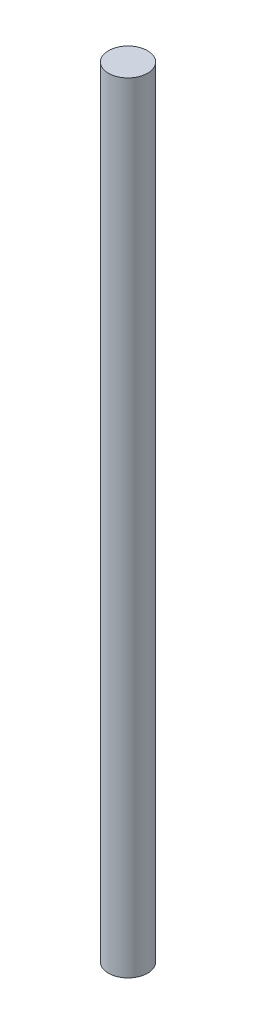
from build123d import *

# Parameters (mm, degrees)
ESBO_O1_W = 39.18
ESBO_O1_H = 1561.37


with BuildPart() as part:
    # Esboço1 → Revolução1 (revolve)
    with BuildSketch(Plane.XY, mode=Mode.PRIVATE) as revolu_o1_sk:
        with Locations((19.59, 780.685)):
            Rectangle(ESBO_O1_W, ESBO_O1_H)
    revolve(revolu_o1_sk.sketch.rotate(Axis((0, 0, 0), (0, 1, 0)), 90), axis=Axis((0, 0, 0), (0, 1, 0)))


solid = part.part
